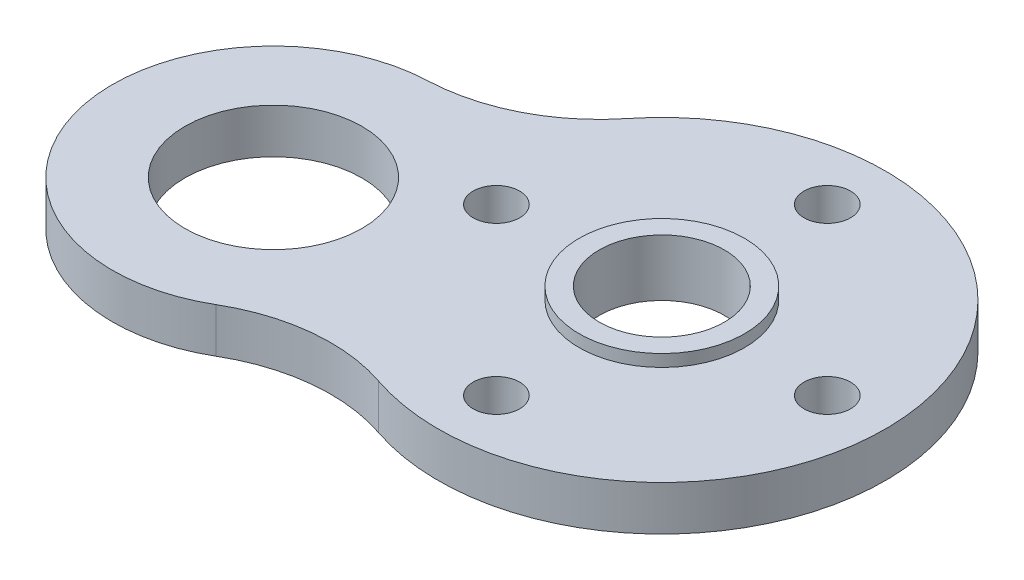
from build123d import *

# Parameters (mm, degrees)
SKETCH2_R           = 25
SKETCH2_R_2         = 2.6
BOSS_EXTRUDE1_DEPTH = 5
SKETCH4_R           = 9.25
BOSS_EXTRUDE2_DEPTH = 1.35
SKETCH3_R           = 7
CUT_EXTRUDE1_DEPTH  = 36.921059283
SKETCH5_R           = 9.9
BOSS_EXTRUDE3_DEPTH = 5
FILLET1_R           = 20


with BuildPart() as part:
    # Sketch2 → Boss-Extrude1 (new body)
    with BuildSketch(Plane(origin=(0, 0, 0), x_dir=(1, 0, 0), z_dir=(0, 1, 0))):
        with Locations(Location((0, 0, 0), (0, 0, 270))):
            Circle(SKETCH2_R)
        with Locations(Location((0, 18.5, 0), (0, 0, 270))):
            Circle(SKETCH2_R_2, mode=Mode.SUBTRACT)
        with Locations(Location((18.5, 0, 0), (0, 0, 270))):
            Circle(SKETCH2_R_2, mode=Mode.SUBTRACT)
        with Locations(Location((0, -18.5, 0), (0, 0, 270))):
            Circle(SKETCH2_R_2, mode=Mode.SUBTRACT)
        with Locations(Location((-18.5, 0, 0), (0, 0, 270))):
            Circle(SKETCH2_R_2, mode=Mode.SUBTRACT)
    extrude(amount=BOSS_EXTRUDE1_DEPTH)

    # Sketch4 → Boss-Extrude2 (add)
    with BuildSketch(Plane(origin=(0, 5, 0), x_dir=(1, 0, 0), z_dir=(0, 1, 0))):
        with Locations(Location((0, 0, 0), (0, 0, 90))):
            Circle(SKETCH4_R)
    extrude(amount=BOSS_EXTRUDE2_DEPTH)

    # Sketch3 → Cut-Extrude1 (cut, through all)
    with BuildSketch(Plane(origin=(0, 6.35, 0), x_dir=(1, 0, 0), z_dir=(0, 1, 0))):
        with Locations(Location((0, 0, 0), (0, 0, 270))):
            Circle(SKETCH3_R)
    extrude(amount=-CUT_EXTRUDE1_DEPTH, mode=Mode.SUBTRACT)

    # Sketch5 → Boss-Extrude3 (add)
    with BuildSketch(Plane.XZ):
        with BuildLine():
            ThreePointArc((-17.474868047, 17.878170677), (-50.857855513, 14.915714286), (-24.362914979, -5.607884962))
            ThreePointArc((-24.362914979, -5.607884962), (-23.989554487, 7.035714286), (-17.474868047, 17.878170677))
        make_face()
        with Locations(Location((-33.585376282, 9.85, 0), (0, 0, 270))):
            Circle(SKETCH5_R, mode=Mode.SUBTRACT)
    extrude(amount=-BOSS_EXTRUDE3_DEPTH)

    # Fillet1
    fillet1_edges = [part.edges().sort_by_distance(p)[0] for p in [
        (-17.474868047, 2.5, 17.878170677),
        (-24.362914979, 2.5, -5.607884962),
    ]]
    fillet(fillet1_edges, radius=FILLET1_R)


solid = part.part
